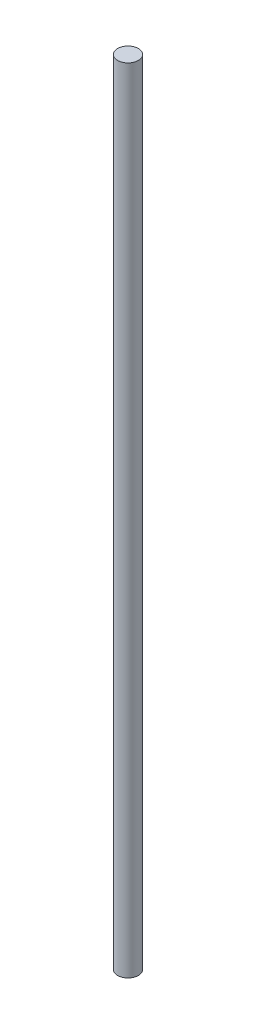
from build123d import *

# Parameters (mm, degrees)
SKETCH1_R           = 3
BOSS_EXTRUDE1_DEPTH = 229.5


with BuildPart() as part:
    # Sketch1 → Boss-Extrude1 (new body)
    with BuildSketch(Plane(origin=(0, 0, 0), x_dir=(1, 0, 0), z_dir=(0, 1, 0))):
        with Locations(Location((0, 0, 0), (0, 0, 270))):
            Circle(SKETCH1_R)
    extrude(amount=BOSS_EXTRUDE1_DEPTH)


solid = part.part
